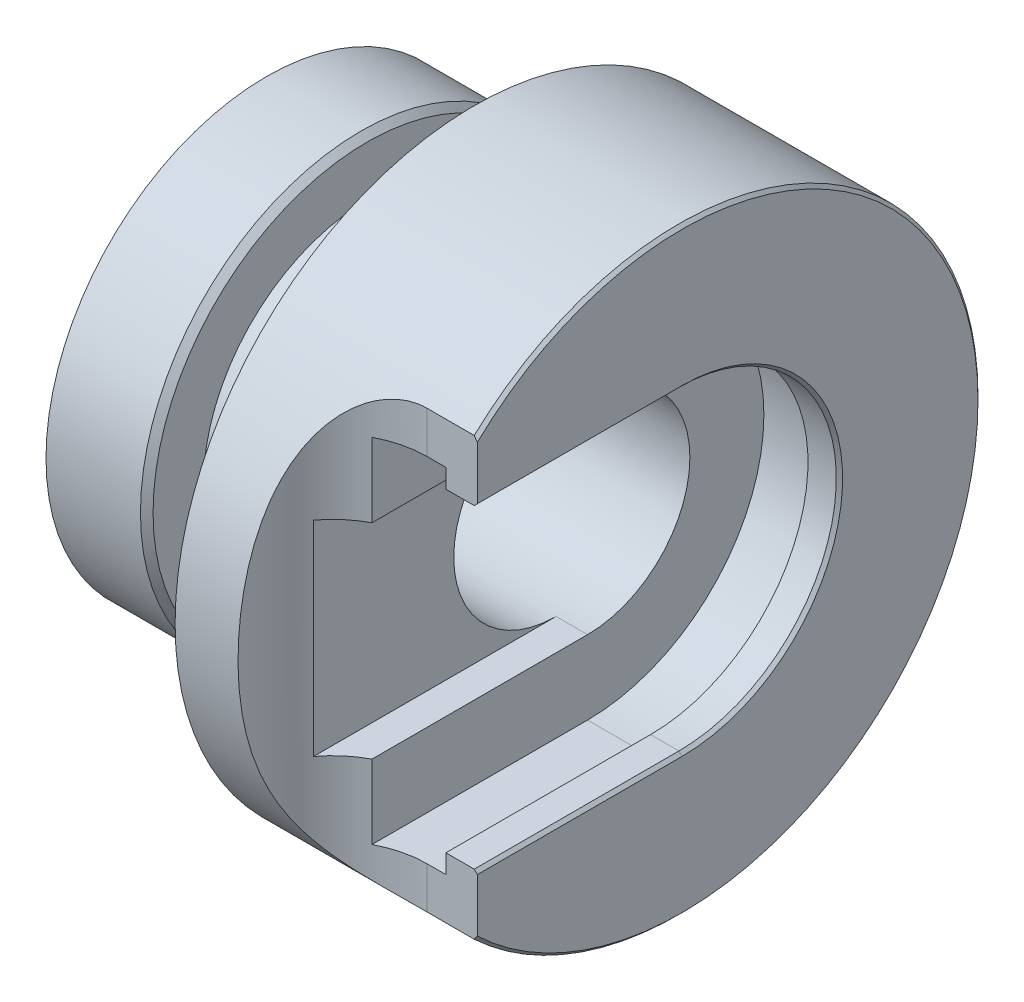
from build123d import *

# Parameters (mm, degrees)
ESBO_O5_W                  = 9.579663193
ESBO_O5_H                  = 10
CORTE_EXTRUS_O3_DEPTH      = 1.5
CORTE_EXTRUS_O4_START      = 2
CORTE_EXTRUS_O4_DEPTH      = 2
ESBO_O8_W                  = 9.704276698
ESBO_O8_H                  = 6.5
CORTE_EXTRUS_O5_DEPTH      = 1
CHANFRO2_SIZE              = 0.2
CHANFRO3_SIZE              = 0.1
CHANFRO4_SIZE              = 0.1
CHANFRO5_SIZE              = 1.5
CORTE_EXTRUS_O6_DEPTH      = 19.834542734
CORTE_EXTRUS_O6_DEPTH_BACK = 19.834542734


with BuildPart() as part:
    # Esboço1 → Revolução1 (revolve)
    with BuildSketch(Plane.XY, mode=Mode.PRIVATE) as revolu_o1_sk:
        Polygon((0, 3.25), (10.2, 3.25), (10.2, 5.6), (12.2, 5.6), (12.2, 5), (13.2, 5), (13.2, 9.5), (6.6, 9.5), (6.6, 5.2), (3.2, 5.2), (3.2, 7), (0, 7), align=None)
    revolve(revolu_o1_sk.sketch.rotate(Axis((0, 0, 0), (1, 0, 0)), 90), axis=Axis((0, 0, 0), (1, 0, 0)))

    # Esboço5 → Corte-extrusão3 (cut)
    with BuildSketch(Plane(origin=(13.2, 0, 0), x_dir=(0, 0, -1), z_dir=(1, 0, 0))):
        with Locations((-4.789831597, 0)):
            Rectangle(ESBO_O5_W, ESBO_O5_H)
    extrude(amount=-CORTE_EXTRUS_O3_DEPTH, mode=Mode.SUBTRACT)

    # Esboço7 → Corte-extrusão4 (cut)
    with BuildSketch(Plane(origin=(10.2, 0, 0), x_dir=(0, 0, -1), z_dir=(1, 0, 0)).offset(CORTE_EXTRUS_O4_START)):
        with BuildLine():
            Line((-9.610816569, -5.6), (0, -5.6))
            ThreePointArc((0, -5.6), (-5.6, 0), (0, 5.6))
            Line((0, 5.6), (-9.610816569, 5.6))
            Line((-9.610816569, 5.6), (-9.610816569, -5.6))
        make_face()
    extrude(amount=-CORTE_EXTRUS_O4_DEPTH, mode=Mode.SUBTRACT)

    # Esboço8 → Corte-extrusão5 (cut)
    with BuildSketch(Plane(origin=(10.2, 0, 0), x_dir=(0, 0, -1), z_dir=(1, 0, 0))):
        with Locations((-4.852138349, 0)):
            Rectangle(ESBO_O8_W, ESBO_O8_H)
    extrude(amount=-CORTE_EXTRUS_O5_DEPTH, mode=Mode.SUBTRACT)

    # Chanfro2
    chanfro2_edges = [part.edges().sort_by_distance(p)[0] for p in [
        (3.2, 0, -7),
    ]]
    chamfer(chanfro2_edges, length=CHANFRO2_SIZE)

    # Chanfro3
    chanfro3_edges = [part.edges().sort_by_distance(p)[0] for p in [
        (13.2, 0, -9.5),
    ]]
    chamfer(chanfro3_edges, length=CHANFRO3_SIZE)

    # Chanfro4
    chanfro4_edges = [part.edges().sort_by_distance(p)[0] for p in [
        (13.2, 5, 3.979949748),
        (13.2, -5, 3.979949748),
        (13.2, 0, -5),
    ]]
    chamfer(chanfro4_edges, length=CHANFRO4_SIZE)

    # Chanfro5
    chanfro5_edges = [part.edges().sort_by_distance(p)[0] for p in [
        (0, 0, -3.25),
    ]]
    chamfer(chanfro5_edges, length=CHANFRO5_SIZE)

    # Esboço9 → Corte-extrusão6 (cut, two sides: drawn at the far end of the back side and taken through both)
    with BuildSketch(Plane(origin=(0, 0, 0), x_dir=(1, 0, 0), z_dir=(0, 1, 0)).offset(-CORTE_EXTRUS_O6_DEPTH_BACK)):
        with BuildLine():
            Line((11.6, -6.5), (13.2, -6.5))
            Line((13.2, -6.5), (13.2, -12.5))
            Line((13.2, -12.5), (11.6, -12.5))
            ThreePointArc((11.6, -12.5), (8.6, -9.5), (11.6, -6.5))
        make_face()
    extrude(amount=CORTE_EXTRUS_O6_DEPTH + CORTE_EXTRUS_O6_DEPTH_BACK, mode=Mode.SUBTRACT)


solid = part.part
